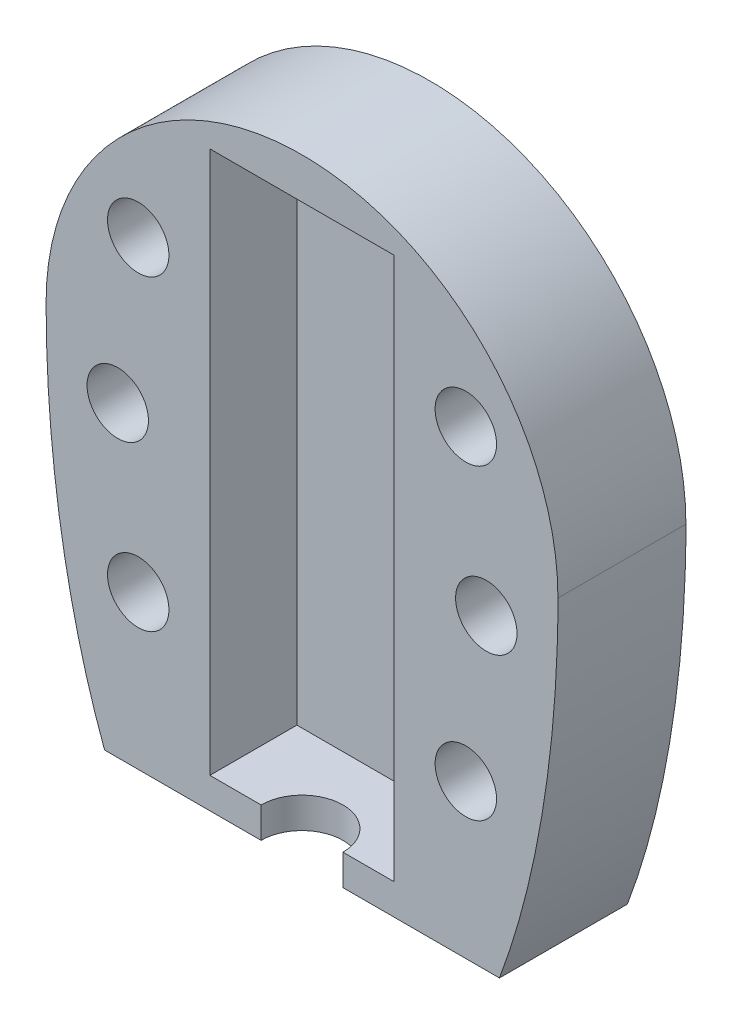
from build123d import *

# Parameters (mm, degrees)
SALIENTE_EXTRUIR5_DEPTH = 12.5
CROQUIS10_W             = 18
CROQUIS10_H             = 53
CORTAR_EXTRUIR1_DEPTH   = 8.5
CROQUIS11_R             = 4
CORTAR_EXTRUIR2_DEPTH   = 8
CROQUIS12_2_R           = 3
CORTAR_EXTRUIR3_DEPTH   = 8.7


with BuildPart() as part:
    # Croquis1 → Saliente-Extruir5 (new body)
    with BuildSketch(Plane.XY):
        with BuildLine():
            Line((-19.284730396, -35), (19.284730396, -35))
            add(Edge.make_bspline(
                [(19.284730396, -35), (25, -19.758503488), (25, 0)],
                knots=[0.881021326, 0.881021326, 0.881021326, 1.570796327, 1.570796327, 1.570796327], degree=2, weights=[1, 0.941113494, 1]))
            ThreePointArc((25, 0), (0, 25), (-25, 0))
            add(Edge.make_bspline(
                [(-25, 0), (-25, -19.758503488), (-19.284730396, -35)],
                knots=[4.71238898, 4.71238898, 4.71238898, 5.402163981, 5.402163981, 5.402163981], degree=2, weights=[1, 0.941113494, 1]))
        make_face()
    extrude(amount=SALIENTE_EXTRUIR5_DEPTH)

    # Croquis10 → Cortar-Extruir1 (cut)
    with BuildSketch(Plane.XY.offset(12.5)):
        with Locations((0, -5.5)):
            Rectangle(CROQUIS10_W, CROQUIS10_H)
    extrude(amount=-CORTAR_EXTRUIR1_DEPTH, mode=Mode.SUBTRACT)

    # Croquis11 → Cortar-Extruir2 (cut)
    with BuildSketch(Plane.XZ.offset(35)):
        with Locations((0, 12.5)):
            Circle(CROQUIS11_R)
    extrude(amount=-CORTAR_EXTRUIR2_DEPTH, mode=Mode.SUBTRACT)

    # Croquis12<2> → Cortar-Extruir3 (cut)
    with BuildSketch(Plane.XY.offset(12.5)):
        with Locations((16, -20)):
            Circle(CROQUIS12_2_R)
        with Locations((16, 10)):
            Circle(CROQUIS12_2_R)
        with Locations((-18, -5)):
            Circle(CROQUIS12_2_R)
        with Locations((18, -5)):
            Circle(CROQUIS12_2_R)
        with Locations((-16, -20)):
            Circle(CROQUIS12_2_R)
        with Locations((-16, 10)):
            Circle(CROQUIS12_2_R)
    extrude(amount=-CORTAR_EXTRUIR3_DEPTH, mode=Mode.SUBTRACT)


solid = part.part
